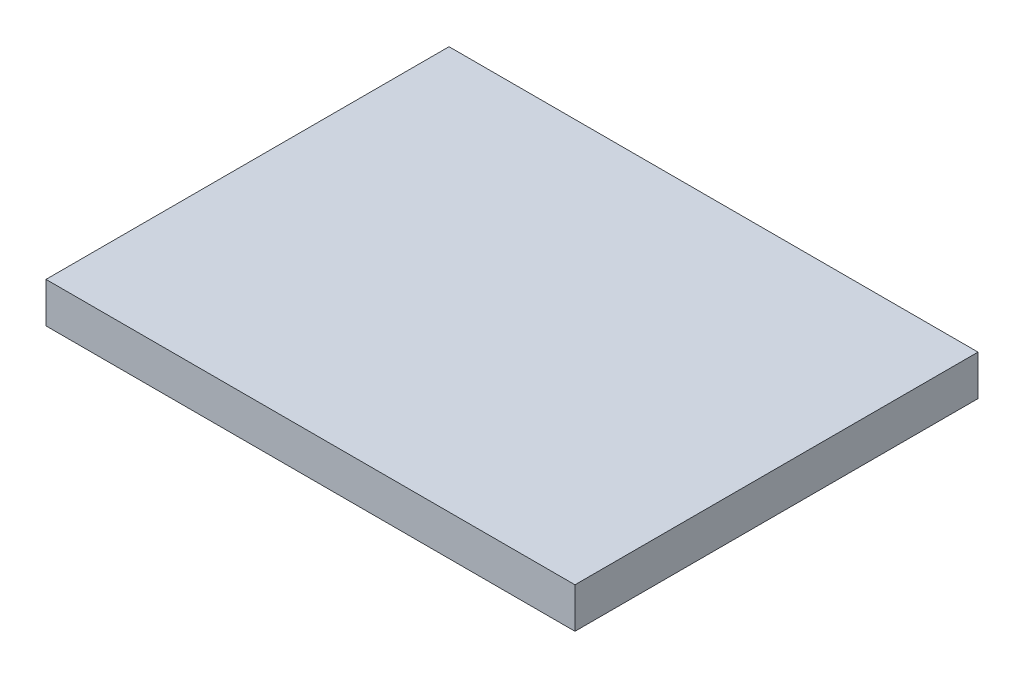
from build123d import *

# Parameters (mm, degrees)
SKETCH1_W           = 21
SKETCH1_H           = 16
BOSS_EXTRUDE1_DEPTH = 1.6


with BuildPart() as part:
    # Sketch1 → Boss-Extrude1 (new body)
    with BuildSketch(Plane(origin=(0, 0, 0), x_dir=(1, 0, 0), z_dir=(0, 1, 0))):
        Rectangle(SKETCH1_W, SKETCH1_H)
    extrude(amount=BOSS_EXTRUDE1_DEPTH)


solid = part.part
